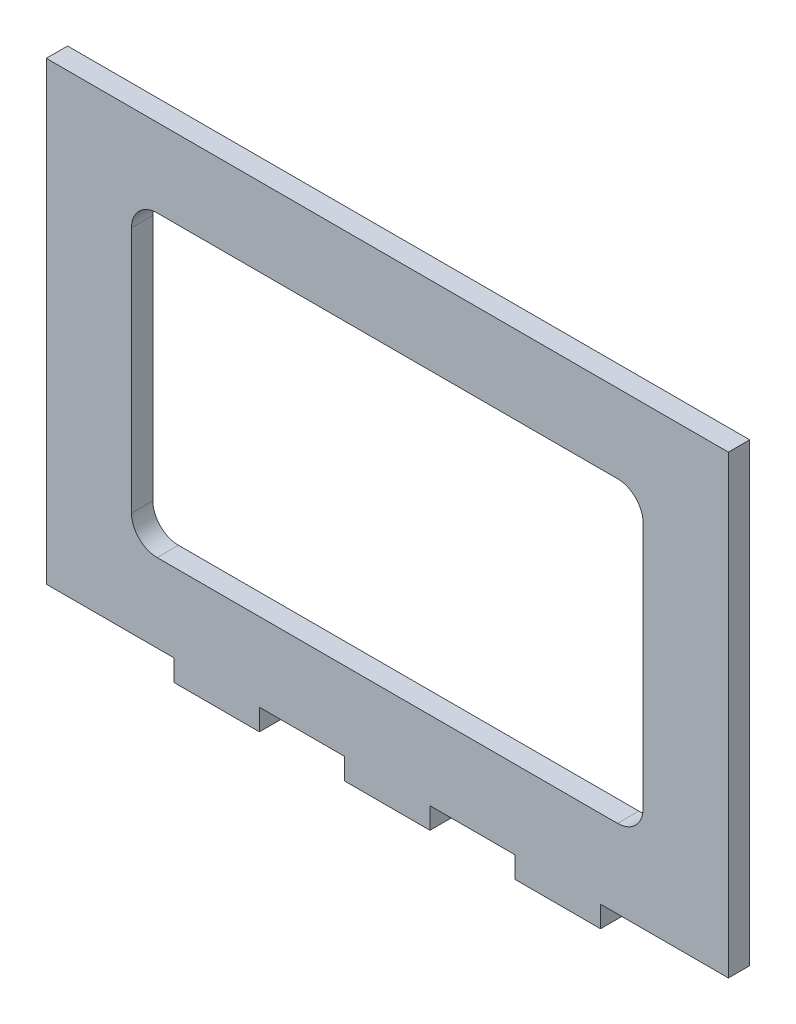
from build123d import *

# Parameters (mm, degrees)
BOSS_EXTRUDE1_DEPTH = 2.5


with BuildPart() as part:
    # Sketch1 → Boss-Extrude1 (new body)
    with BuildSketch(Plane.XY):
        Polygon((-40, -26.705), (-25, -26.705), (-25, -29.205), (-15, -29.205), (-15, -26.705), (-5, -26.705), (-5, -29.205), (5, -29.205), (5, -26.705), (15, -26.705), (15, -29.205), (25, -29.205), (25, -26.705), (35, -26.705), (40, -26.705), (40, 26.705), (-40, 26.705), align=None)
        with BuildLine():
            Line((-27, -17.5), (27, -17.5))
            ThreePointArc((27, -17.5), (29.121320344, -16.621320344), (30, -14.5))
            Line((30, -14.5), (30, 14.5))
            ThreePointArc((30, 14.5), (29.121320344, 16.621320344), (27, 17.5))
            Line((27, 17.5), (-27, 17.5))
            ThreePointArc((-27, 17.5), (-29.121320344, 16.621320344), (-30, 14.5))
            Line((-30, 14.5), (-30, -14.5))
            ThreePointArc((-30, -14.5), (-29.121320344, -16.621320344), (-27, -17.5))
        make_face(mode=Mode.SUBTRACT)
    extrude(amount=BOSS_EXTRUDE1_DEPTH)


solid = part.part
